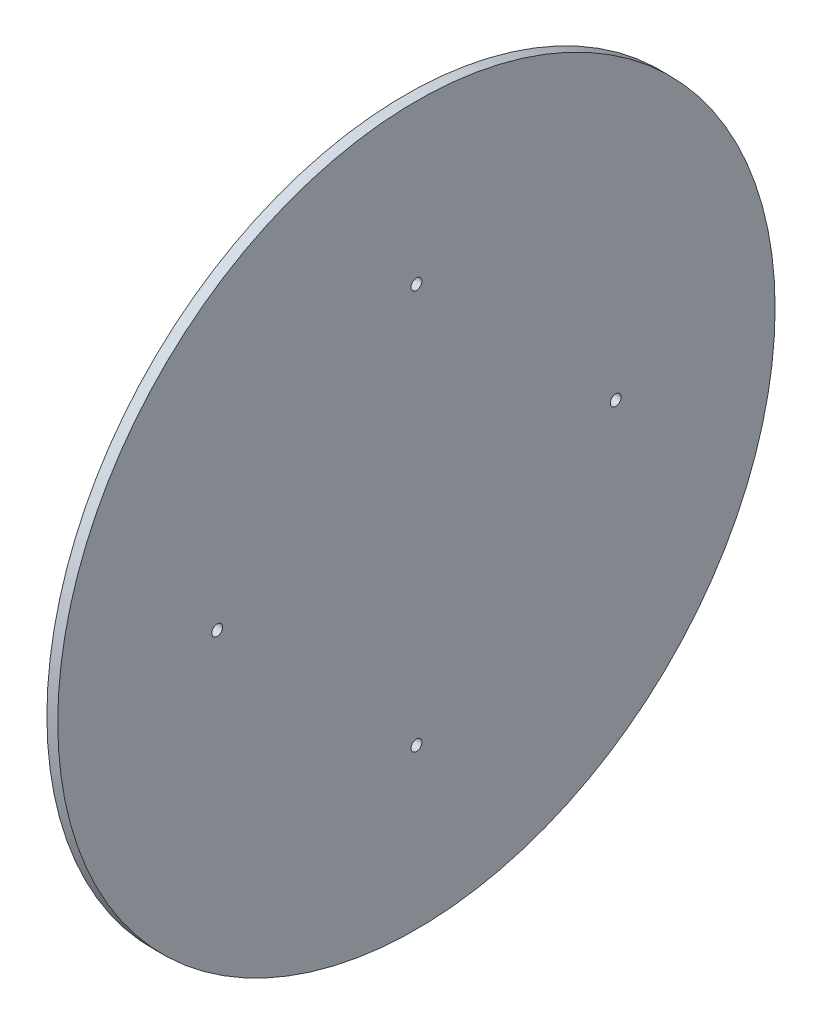
from build123d import *

# Parameters (mm, degrees)
SKETCH1_R           = 99
SKETCH1_R_2         = 1.5
BOSS_EXTRUDE2_DEPTH = 3


with BuildPart() as part:
    # Sketch1 → Boss-Extrude2 (new body)
    with BuildSketch(Plane(origin=(0, 0, 0), x_dir=(0, 0, -1), z_dir=(1, 0, 0))):
        Circle(SKETCH1_R)
        with Locations((-55, 0)):
            Circle(SKETCH1_R_2, mode=Mode.SUBTRACT)
        with Locations((0.00584185, 55.206210587)):
            Circle(SKETCH1_R_2, mode=Mode.SUBTRACT)
        with Locations((55, 0)):
            Circle(SKETCH1_R_2, mode=Mode.SUBTRACT)
        with Locations((0, -55)):
            Circle(SKETCH1_R_2, mode=Mode.SUBTRACT)
    extrude(amount=BOSS_EXTRUDE2_DEPTH)


solid = part.part
